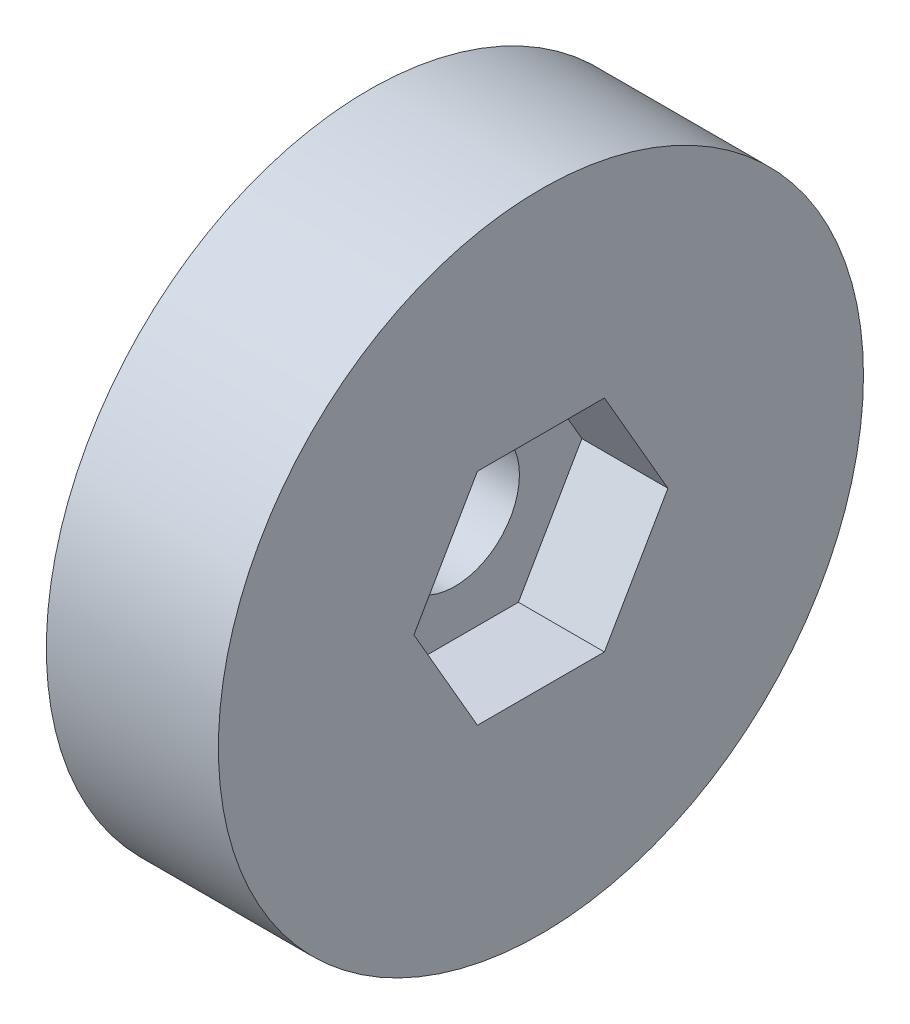
from build123d import *

# Parameters (mm, degrees)
SKETCH1_R           = 19.05
SKETCH1_R_2         = 3.81
BOSS_EXTRUDE1_DEPTH = 5.08
SKETCH2_R           = 19.05
BOSS_EXTRUDE2_DEPTH = 5.08


with BuildPart() as part:
    # Sketch1 → Boss-Extrude1 (new body)
    with BuildSketch(Plane(origin=(0, 0, 0), x_dir=(0, 0, -1), z_dir=(1, 0, 0))):
        Circle(SKETCH1_R)
        Circle(SKETCH1_R_2, mode=Mode.SUBTRACT)
    extrude(amount=BOSS_EXTRUDE1_DEPTH)

    # Sketch2 → Boss-Extrude2 (add)
    with BuildSketch(Plane(origin=(5.08, 0, 0), x_dir=(0, 0, -1), z_dir=(1, 0, 0))):
        Circle(SKETCH2_R)
        Polygon((7.5, 0), (3.75, 6.495190528), (-3.75, 6.495190528), (-7.5, 0), (-3.75, -6.495190528), (3.75, -6.495190528), align=None, mode=Mode.SUBTRACT)
    extrude(amount=BOSS_EXTRUDE2_DEPTH)


solid = part.part
